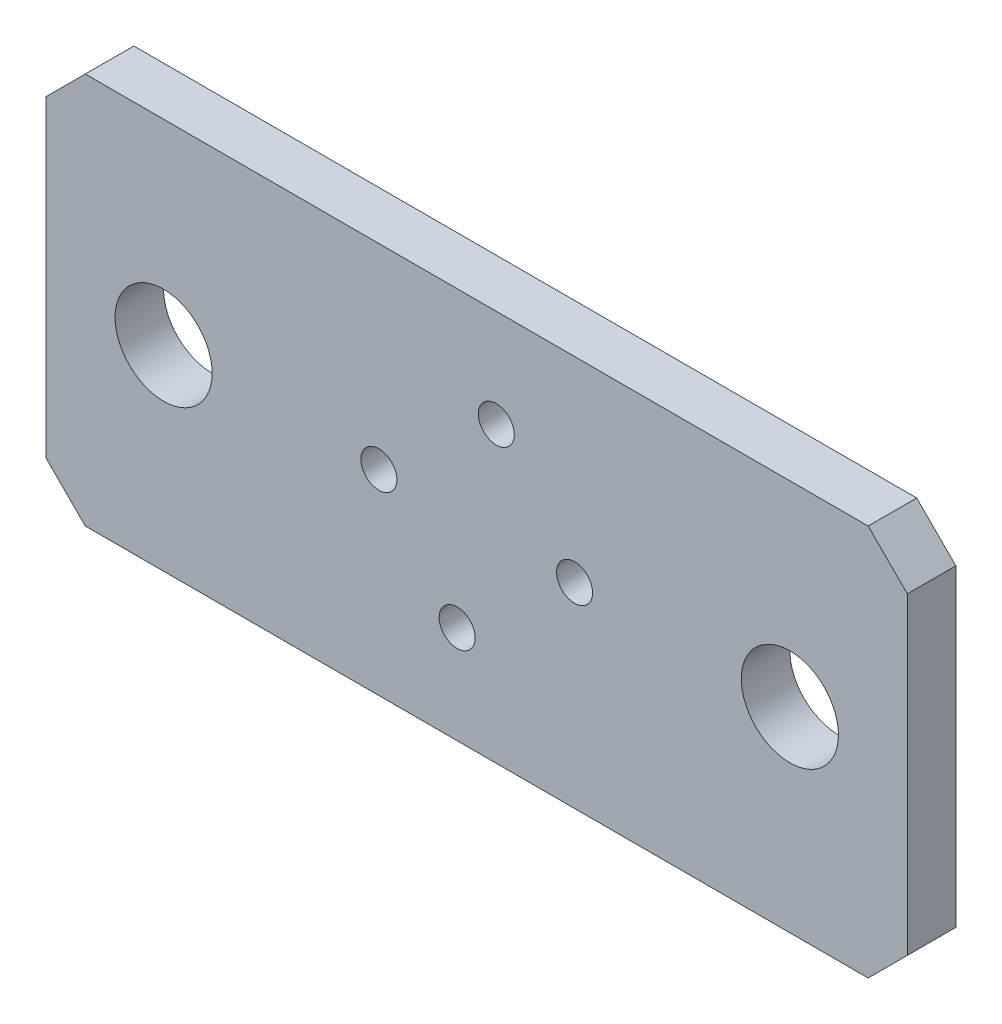
from build123d import *

# Parameters (mm, degrees)
MODEL_R             = 0.5842
MODEL_R_2           = 1.5748
BOSS_EXTRUDE1_DEPTH = 1.5748


with BuildPart() as part:
    # Model → Boss-Extrude1 (new body)
    with BuildSketch(Plane.XY):
        Polygon((0, 11.43), (1.27, 12.7), (26.67, 12.7), (27.94, 11.43), (27.94, 1.27), (26.67, 0), (1.27, 0), (0, 1.27), align=None)
        with Locations((10.795, 6.35)):
            Circle(MODEL_R, mode=Mode.SUBTRACT)
        with Locations((17.145, 6.35)):
            Circle(MODEL_R, mode=Mode.SUBTRACT)
        with Locations((3.81, 6.35)):
            Circle(MODEL_R_2, mode=Mode.SUBTRACT)
        with Locations((24.13, 6.35)):
            Circle(MODEL_R_2, mode=Mode.SUBTRACT)
        with Locations((13.335, 3.175)):
            Circle(MODEL_R, mode=Mode.SUBTRACT)
        with Locations((14.605, 9.525)):
            Circle(MODEL_R, mode=Mode.SUBTRACT)
    extrude(amount=BOSS_EXTRUDE1_DEPTH)


solid = part.part
